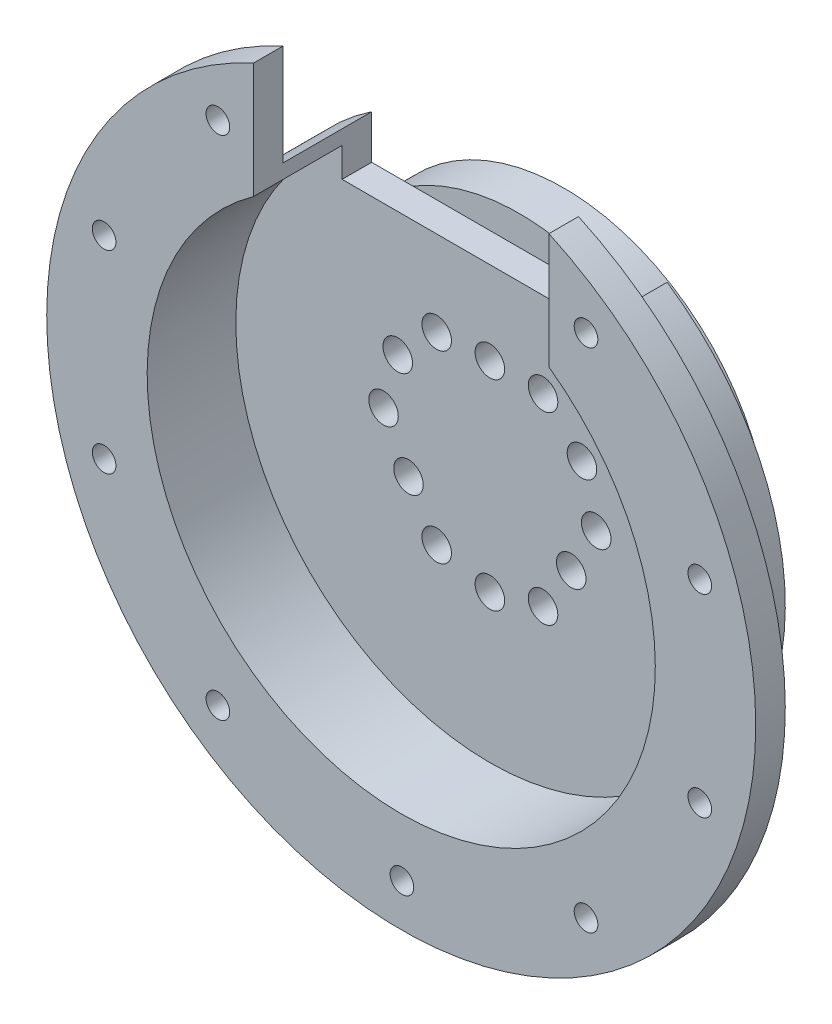
from build123d import *

# Parameters (mm, degrees)
SKETCH1_R           = 45
BOSS_EXTRUDE1_DEPTH = 5
SKETCH2_R           = 2.5
CUT_EXTRUDE1_DEPTH  = 5
SKETCH3_R           = 45
SKETCH3_R_2         = 43
BOSS_EXTRUDE2_DEPTH = 10
SKETCH4_R           = 60
SKETCH4_R_2         = 43
BOSS_EXTRUDE3_DEPTH = 5
SKETCH5_R           = 2
CUT_EXTRUDE2_DEPTH  = 5
CUT_EXTRUDE3_START  = 30
CUT_EXTRUDE3_DEPTH  = 81
SKETCH7_R           = 35
SKETCH7_R_2         = 2.5
BOSS_EXTRUDE4_DEPTH = 7.5


with BuildPart() as part:
    # Sketch1 → Boss-Extrude1 (new body)
    with BuildSketch(Plane.XY):
        Circle(SKETCH1_R)
    extrude(amount=BOSS_EXTRUDE1_DEPTH)

    # Sketch2 → Cut-Extrude1 (cut)
    with BuildSketch(Plane.XY.offset(5)):
        with Locations((0, 15.9)):
            Circle(SKETCH2_R)
        with Locations((13.76980392, -7.95)):
            Circle(SKETCH2_R)
        with Locations((-13.76980392, -7.95)):
            Circle(SKETCH2_R)
        with Locations((9, 15.588457268)):
            Circle(SKETCH2_R)
        with Locations((15.588457268, 9)):
            Circle(SKETCH2_R)
        with Locations((18, 0)):
            Circle(SKETCH2_R)
        with Locations((9, -15.588457268)):
            Circle(SKETCH2_R)
        with Locations((0, -18)):
            Circle(SKETCH2_R)
        with Locations((-9, -15.588457268)):
            Circle(SKETCH2_R)
        with Locations((-18, 0)):
            Circle(SKETCH2_R)
        with Locations((-15.588457268, 9)):
            Circle(SKETCH2_R)
        with Locations((-9, 15.588457268)):
            Circle(SKETCH2_R)
    extrude(amount=-CUT_EXTRUDE1_DEPTH, mode=Mode.SUBTRACT)

    # Sketch3 → Boss-Extrude2 (add)
    with BuildSketch(Plane.XY.offset(5)):
        Circle(SKETCH3_R)
        Circle(SKETCH3_R_2, mode=Mode.SUBTRACT)
    extrude(amount=BOSS_EXTRUDE2_DEPTH)

    # Sketch4 → Boss-Extrude3 (add)
    with BuildSketch(Plane.XY.offset(15)):
        Circle(SKETCH4_R)
        Circle(SKETCH4_R_2, mode=Mode.SUBTRACT)
    extrude(amount=BOSS_EXTRUDE3_DEPTH)

    # Sketch5 → Cut-Extrude2 (cut)
    with BuildSketch(Plane.XY.offset(20)):
        with Locations((0, 53)):
            Circle(SKETCH5_R)
        with Locations((31.274207169, 43.143144086)):
            Circle(SKETCH5_R)
        with Locations((50.527584161, 16.643144086)):
            Circle(SKETCH5_R)
        with Locations((50.527584161, -16.112657318)):
            Circle(SKETCH5_R)
        with Locations((31.274207169, -42.612657318)):
            Circle(SKETCH5_R)
        with Locations((0.121588798, -52.734756616)):
            Circle(SKETCH5_R)
        with Locations((-31.031029574, -42.612657318)):
            Circle(SKETCH5_R)
        with Locations((-50.284406566, -16.112657318)):
            Circle(SKETCH5_R)
        with Locations((-50.284406566, 16.643144086)):
            Circle(SKETCH5_R)
        with Locations((-31.031029574, 43.143144086)):
            Circle(SKETCH5_R)
    extrude(amount=-CUT_EXTRUDE2_DEPTH, mode=Mode.SUBTRACT)

    # Sketch6 → Cut-Extrude3 (cut)
    with BuildSketch(Plane(origin=(0, 0, 0), x_dir=(1, 0, 0), z_dir=(0, 1, 0)).offset(CUT_EXTRUDE3_START)):
        Polygon((-25, -15), (-25, 5), (25, 5), (25, -15), (25, -26.812611245), (-25, -26.812611245), align=None)
    extrude(amount=CUT_EXTRUDE3_DEPTH, mode=Mode.SUBTRACT)

    # Sketch7 → Boss-Extrude4 (add)
    with BuildSketch(Plane(origin=(0, 0, 0), x_dir=(-1, 0, 0), z_dir=(0, 0, -1))):
        with Locations(Location((0, 0, 0), (0, 0, 121.002719134))):
            Circle(SKETCH7_R)
        with Locations(Location((-15.588457268, 9, 0), (0, 0, 180))):
            Circle(SKETCH7_R_2, mode=Mode.SUBTRACT)
        with Locations(Location((-18, 0, 0), (0, 0, 180))):
            Circle(SKETCH7_R_2, mode=Mode.SUBTRACT)
        with Locations(Location((-13.76980392, -7.95, 0), (0, 0, 180))):
            Circle(SKETCH7_R_2, mode=Mode.SUBTRACT)
        with Locations(Location((-9, -15.588457268, 0), (0, 0, 180))):
            Circle(SKETCH7_R_2, mode=Mode.SUBTRACT)
        with Locations(Location((0, -18, 0), (0, 0, 180))):
            Circle(SKETCH7_R_2, mode=Mode.SUBTRACT)
        with Locations(Location((9, -15.588457268, 0), (0, 0, 180))):
            Circle(SKETCH7_R_2, mode=Mode.SUBTRACT)
        with Locations(Location((13.76980392, -7.95, 0), (0, 0, 180))):
            Circle(SKETCH7_R_2, mode=Mode.SUBTRACT)
        with Locations(Location((18, 0, 0), (0, 0, 180))):
            Circle(SKETCH7_R_2, mode=Mode.SUBTRACT)
        with Locations(Location((15.588457268, 9, 0), (0, 0, 180))):
            Circle(SKETCH7_R_2, mode=Mode.SUBTRACT)
        with Locations(Location((9, 15.588457268, 0), (0, 0, 180))):
            Circle(SKETCH7_R_2, mode=Mode.SUBTRACT)
        with Locations(Location((0, 15.9, 0), (0, 0, 180))):
            Circle(SKETCH7_R_2, mode=Mode.SUBTRACT)
        with Locations(Location((-9, 15.588457268, 0), (0, 0, 180))):
            Circle(SKETCH7_R_2, mode=Mode.SUBTRACT)
    extrude(amount=BOSS_EXTRUDE4_DEPTH)


solid = part.part
